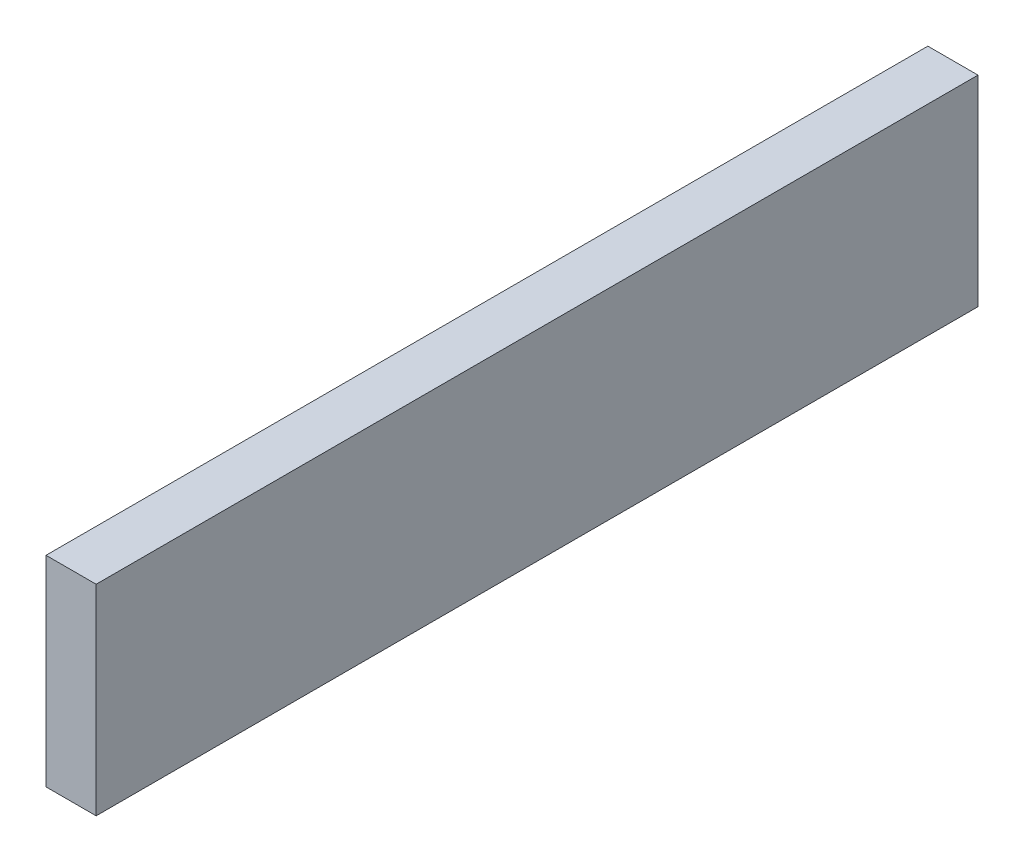
from build123d import *

# Parameters (mm, degrees)
SKETCH1_W           = 670.000000104
SKETCH1_H           = 152.4
BOSS_EXTRUDE1_DEPTH = 38.1


with BuildPart() as part:
    # Sketch1 → Boss-Extrude1 (new body)
    with BuildSketch(Plane(origin=(0, 0, 0), x_dir=(0, 0, -1), z_dir=(1, 0, 0))):
        Rectangle(SKETCH1_W, SKETCH1_H)
    extrude(amount=BOSS_EXTRUDE1_DEPTH)


solid = part.part
